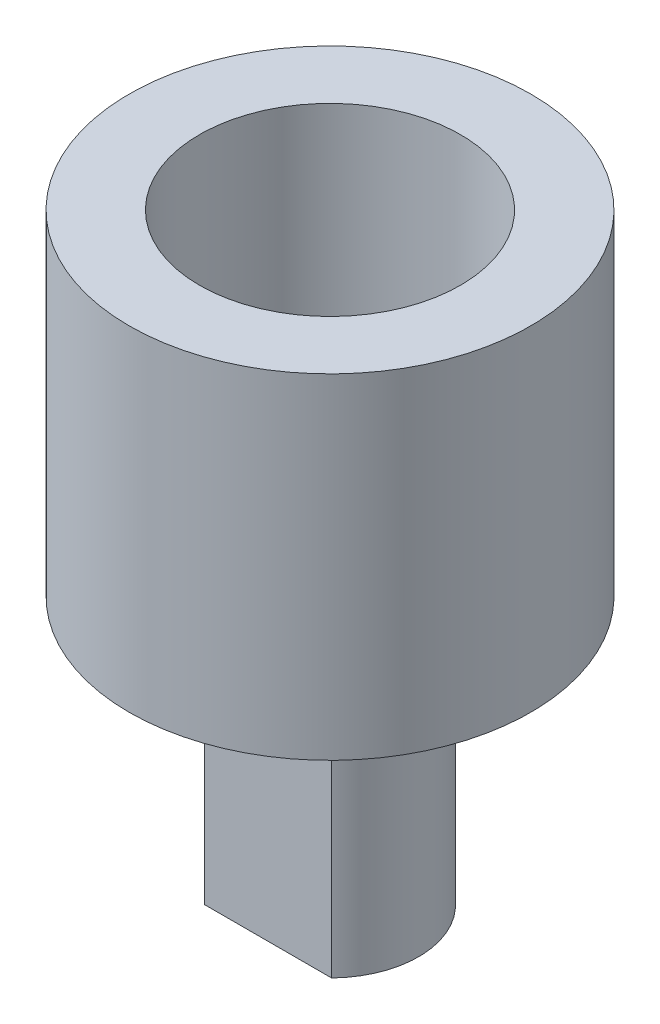
from build123d import *

# Parameters (mm, degrees)
SKETCH1_R           = 6
BOSS_EXTRUDE1_DEPTH = 2
SKETCH2_R           = 6
SKETCH2_R_2         = 3.9
BOSS_EXTRUDE2_DEPTH = 8
BOSS_EXTRUDE3_DEPTH = 8


with BuildPart() as part:
    # Sketch1 → Boss-Extrude1 (new body)
    with BuildSketch(Plane(origin=(0, 0, 0), x_dir=(1, 0, 0), z_dir=(0, 1, 0))):
        with Locations(Location((0, 0, 0), (0, 0, 270))):
            Circle(SKETCH1_R)
    extrude(amount=BOSS_EXTRUDE1_DEPTH)

    # Sketch2 → Boss-Extrude2 (add)
    with BuildSketch(Plane(origin=(0, 2, 0), x_dir=(1, 0, 0), z_dir=(0, 1, 0))):
        with Locations(Location((0, 0, 0), (0, 0, 270))):
            Circle(SKETCH2_R)
        with Locations(Location((0, 0, 0), (0, 0, 270))):
            Circle(SKETCH2_R_2, mode=Mode.SUBTRACT)
    extrude(amount=BOSS_EXTRUDE2_DEPTH)

    # Sketch3 → Boss-Extrude3 (add)
    with BuildSketch(Plane.XZ):
        with BuildLine():
            Line((-1.897366596, 1.85), (1.897366596, 1.85))
            ThreePointArc((1.897366596, 1.85), (2.649775646, 0.034482248), (1.944865034, -1.8))
            Line((1.944865034, -1.8), (-1.944865034, -1.8))
            ThreePointArc((-1.944865034, -1.8), (-2.649775646, 0.034482248), (-1.897366596, 1.85))
        make_face()
    extrude(amount=BOSS_EXTRUDE3_DEPTH)


solid = part.part
